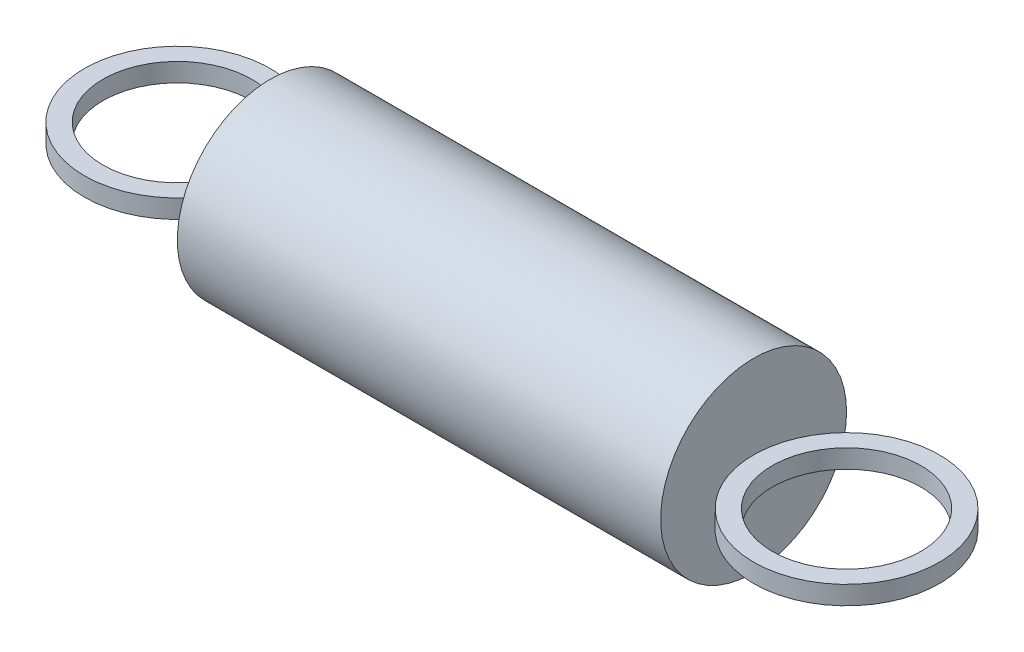
from build123d import *

# Parameters (mm, degrees)
SKETCH1_R             = 3.96875
BOSS_EXTRUDE1_DEPTH   = 20.6375
SKETCH3_R             = 3.96875
SKETCH3_R_2           = 3.175
BOSS_EXTRUDE2_DEPTH   = 0.396875
BOSS_EXTRUDE2_2_DEPTH = 0.396875


with BuildPart() as part:
    # Sketch1 → Boss-Extrude1 (new body)
    with BuildSketch(Plane(origin=(0, 0, 0), x_dir=(0, 0, -1), z_dir=(1, 0, 0))):
        Circle(SKETCH1_R)
    extrude(amount=BOSS_EXTRUDE1_DEPTH)


with BuildPart() as body_2:
    # Sketch3 → Boss-Extrude2 (new, symmetric)
    with BuildSketch(Plane(origin=(0, 0, 0), x_dir=(1, 0, 0), z_dir=(0, 1, 0))):
        with Locations(Location((-3.96875, 0, 0), (0, 0, 270))):
            Circle(SKETCH3_R)
        with Locations(Location((-3.96875, 0, 0), (0, 0, 270))):
            Circle(SKETCH3_R_2, mode=Mode.SUBTRACT)
    extrude(amount=BOSS_EXTRUDE2_DEPTH, both=True)


with BuildPart() as body_3:
    # Sketch3 → Boss-Extrude2 2 (new, symmetric)
    with BuildSketch(Plane(origin=(0, 0, 0), x_dir=(1, 0, 0), z_dir=(0, 1, 0))):
        with Locations(Location((24.60625, 0, 0), (0, 0, 270))):
            Circle(SKETCH3_R)
        with Locations(Location((24.60625, 0, 0), (0, 0, 270))):
            Circle(SKETCH3_R_2, mode=Mode.SUBTRACT)
    extrude(amount=BOSS_EXTRUDE2_2_DEPTH, both=True)


solid = Compound([part.part, body_2.part, body_3.part])
